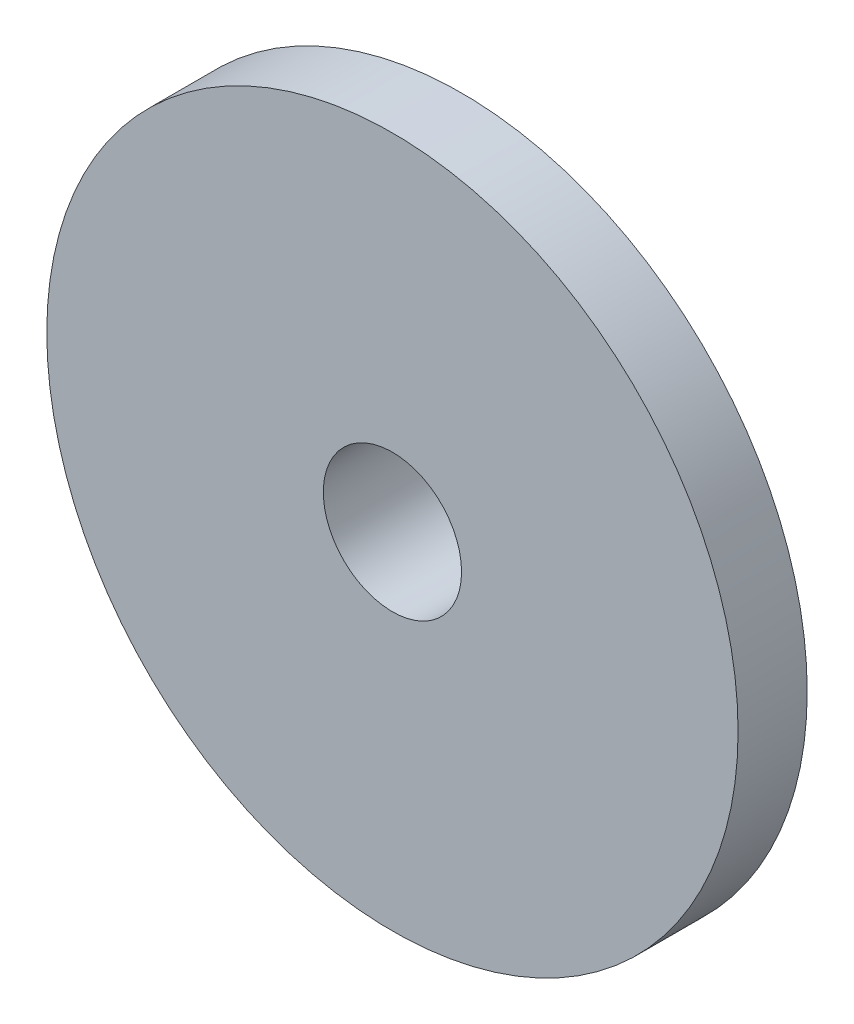
from build123d import *

# Parameters (mm, degrees)
SKETCH1_R           = 3.5
SKETCH1_R_2         = 1.5
BOSS_EXTRUDE1_DEPTH = 1
SKETCH2_R           = 7.5
SKETCH2_R_2         = 1.5
BOSS_EXTRUDE2_DEPTH = 1.5


with BuildPart() as part:
    # Sketch1 → Boss-Extrude1 (new body)
    with BuildSketch(Plane.XY):
        Circle(SKETCH1_R)
        Circle(SKETCH1_R_2, mode=Mode.SUBTRACT)
    extrude(amount=BOSS_EXTRUDE1_DEPTH)

    # Sketch2 → Boss-Extrude2 (add)
    with BuildSketch(Plane.XY.offset(1)):
        Circle(SKETCH2_R)
        Circle(SKETCH2_R_2, mode=Mode.SUBTRACT)
    extrude(amount=BOSS_EXTRUDE2_DEPTH)


solid = part.part
